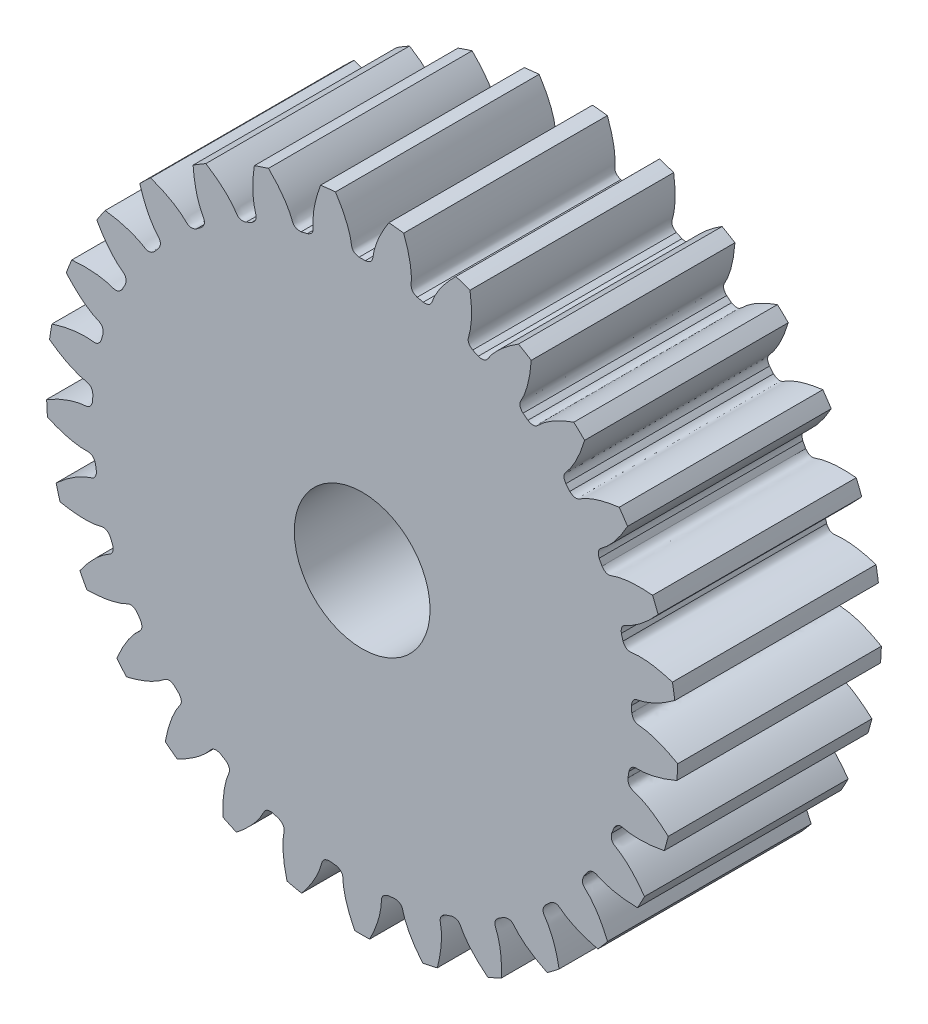
from build123d import *

# Parameters (mm, degrees)
SKETCH_1_R               = 46.5
EXTRUDE_1_DEPTH          = 30
CUT_EXTRUDE_1_DEPTH      = 73.280702819
PATTERN_CIRCULAR_1_COUNT = 29
SKETCH_4_R               = 10
CUT_EXTRUDE_2_DEPTH      = 300


with BuildPart() as part:
    # 草图1 → 凸台-拉伸1 (new body)
    with BuildSketch(Plane.XY):
        Circle(SKETCH_1_R)
    extrude(amount=EXTRUDE_1_DEPTH)

    # 草图2 → 切除-拉伸1 (cut, through all)
    with BuildSketch(Plane.XY):
        with BuildLine():
            ThreePointArc((0.453450673, 39.747413532), (0, 39.75), (-0.453450673, 39.747413532))
            add(Edge.make_bspline(
                [(-0.453450673, 39.747413532), (-1.569778222, 39.913613133), (-1.541995318, 40.588892763), (-1.664996231, 41.279363659), (-1.689679983, 41.404141332), (-1.720372867, 41.544365561), (-1.75765879, 41.699853784), (-1.80217249, 41.870387485), (-1.854524785, 42.055734861), (-1.915325503, 42.255643868), (-1.985175708, 42.469844605), (-2.064669439, 42.69804882), (-2.154392551, 42.939950311), (-2.254922428, 43.195225072), (-2.366827454, 43.463531536), (-2.490666557, 43.744510795), (-2.626988737, 44.037786853), (-2.776332612, 44.342966876), (-2.939225961, 44.659641462), (-3.11618528, 44.987384921), (-3.307715343, 45.325755561), (-3.51430877, 45.674295992), (-3.736445599, 46.032533436), (-3.974592876, 46.399980052), (-4.229204237, 46.776133265), (-4.500719513, 47.160476113), (-4.789564336, 47.552477598), (-5.096149754, 47.951593051), (-5.420871858, 48.357264503), (-5.764111413, 48.768921069), (-6.126233506, 49.185979341), (-6.507587193, 49.607843784), (-6.908505169, 50.033907152), (-7.329303428, 50.463550903), (-7.770280986, 50.896145622), (-8.231719423, 51.331051468), (-8.882685208, 51.920457555), (-9.390408175, 52.352854468), (-9.738593025, 52.637855109)],
                knots=[0, 0, 0, 0, 0.115495494, 0.122355409, 0.130227304, 0.13911118, 0.149007036, 0.159914872, 0.171834689, 0.184766485, 0.198710262, 0.213666019, 0.229633757, 0.246613475, 0.264605172, 0.283608851, 0.303624509, 0.324652148, 0.346691767, 0.369743366, 0.393806946, 0.418882505, 0.444970045, 0.472069565, 0.500181066, 0.529304547, 0.559440008, 0.590587449, 0.622746871, 0.655918272, 0.690101654, 0.725297017, 0.761504359, 0.798723682, 0.836954985, 0.876198268, 0.916453532, 1, 1, 1, 1], degree=3))
            ThreePointArc((-9.738593025, 52.637855109), (0, 53.531149666), (9.738593025, 52.637855109))
            add(Edge.make_bspline(
                [(0.453450673, 39.747413532), (1.569778222, 39.913613133), (1.541995318, 40.588892763), (1.664996231, 41.279363659), (1.689679983, 41.404141332), (1.720372867, 41.544365561), (1.75765879, 41.699853784), (1.80217249, 41.870387485), (1.854524785, 42.055734861), (1.915325503, 42.255643868), (1.985175708, 42.469844605), (2.064669439, 42.69804882), (2.154392551, 42.939950311), (2.254922428, 43.195225072), (2.366827454, 43.463531536), (2.490666557, 43.744510795), (2.626988737, 44.037786853), (2.776332612, 44.342966876), (2.939225961, 44.659641462), (3.11618528, 44.987384921), (3.307715343, 45.325755561), (3.51430877, 45.674295992), (3.736445599, 46.032533436), (3.974592876, 46.399980052), (4.229204237, 46.776133265), (4.500719513, 47.160476113), (4.789564336, 47.552477598), (5.096149754, 47.951593051), (5.420871858, 48.357264503), (5.764111413, 48.768921069), (6.126233506, 49.185979341), (6.507587193, 49.607843784), (6.908505169, 50.033907152), (7.329303428, 50.463550903), (7.770280986, 50.896145622), (8.231719423, 51.331051468), (8.882685208, 51.920457555), (9.390408175, 52.352854468), (9.738593025, 52.637855109)],
                knots=[0, 0, 0, 0, 0.115495494, 0.122355409, 0.130227304, 0.13911118, 0.149007036, 0.159914872, 0.171834689, 0.184766485, 0.198710262, 0.213666019, 0.229633757, 0.246613475, 0.264605172, 0.283608851, 0.303624509, 0.324652148, 0.346691767, 0.369743366, 0.393806946, 0.418882505, 0.444970045, 0.472069565, 0.500181066, 0.529304547, 0.559440008, 0.590587449, 0.622746871, 0.655918272, 0.690101654, 0.725297017, 0.761504359, 0.798723682, 0.836954985, 0.876198268, 0.916453532, 1, 1, 1, 1], degree=3))
        make_face()
    cut_extrude_1 = extrude(amount=CUT_EXTRUDE_1_DEPTH, mode=Mode.SUBTRACT)

    # 阵列(圆周)1: 切除-拉伸1 ×29 about axis
    pattern_circular_1_axis = Axis((0, 0, 30), (0, 0, -1))
    for i in range(1, PATTERN_CIRCULAR_1_COUNT):
        add(cut_extrude_1.rotate(pattern_circular_1_axis, i * 360 / PATTERN_CIRCULAR_1_COUNT), mode=Mode.SUBTRACT)

    # 草图4 → 切除-拉伸2 (cut)
    with BuildSketch(Plane(origin=(0, 0, 0), x_dir=(-1, 0, 0), z_dir=(0, 0, -1))):
        Circle(SKETCH_4_R)
    extrude(amount=-CUT_EXTRUDE_2_DEPTH, mode=Mode.SUBTRACT)


solid = part.part
